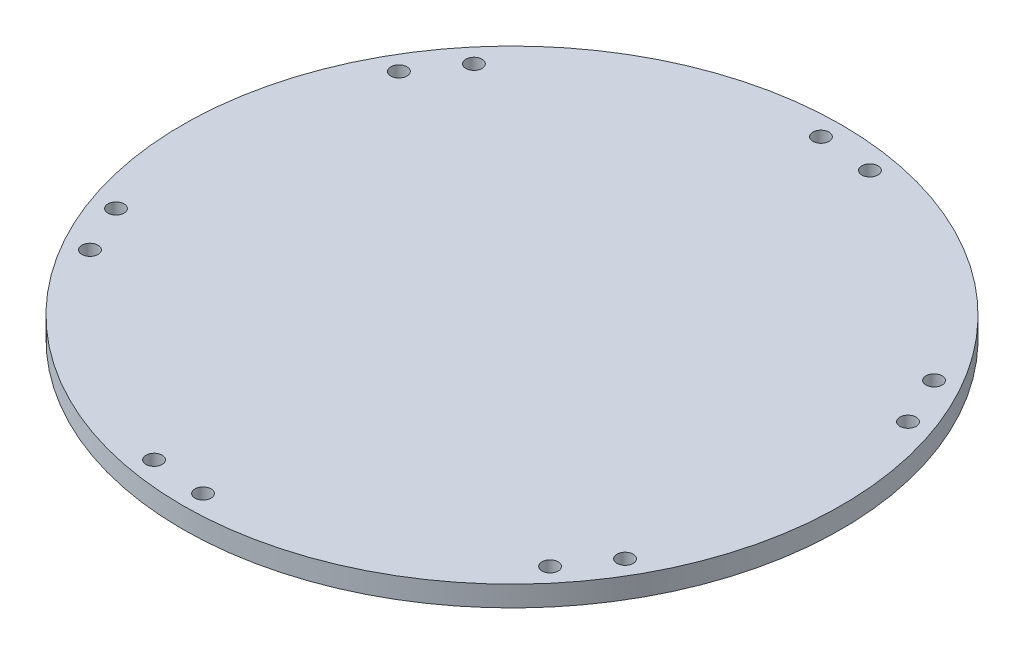
from build123d import *

# Parameters (mm, degrees)
BACK_PLATE_MAIN_R          = 101.6
BOSS_EXTRUDE1_DEPTH        = 6.35
F_9_0_196_DIAMETER_HOLE1_D = 4.9784
CLEARANCE_CUTOUT_R         = 25.4
CUT_EXTRUDE1_DEPTH         = 3.81


with BuildPart() as part:
    # Back Plate Main → Boss-Extrude1 (new body)
    with BuildSketch(Plane(origin=(0, 0, 0), x_dir=(1, 0, 0), z_dir=(0, 1, 0))):
        with Locations(Location((0, 0, 0), (0, 0, 270))):
            Circle(BACK_PLATE_MAIN_R)
    extrude(amount=-BOSS_EXTRUDE1_DEPTH)

    # #9 (0.196) Diameter Hole1 (through all)
    with Locations(Plane(origin=(0, 0, 0), x_dir=(1, 0, 0), z_dir=(0, 1, 0))):
        with Locations((0, 95.25), (82.48891971, 47.625), (82.48891971, -47.625), (0, -95.25), (-82.48891971, -47.625), (-82.48891971, 47.625), (-72.965733207, 61.225519823), (16.539988923, 93.802938474), (89.50572213, 32.577418652), (72.965733207, -61.225519823), (-16.539988923, -93.802938474), (-89.50572213, -32.577418652)):
            Hole(F_9_0_196_DIAMETER_HOLE1_D / 2)

    # Clearance Cutout → Cut-Extrude1 (cut)
    with BuildSketch(Plane.XZ.offset(6.35)):
        with Locations(Location((0, 0, 0), (0, 0, 270))):
            Circle(CLEARANCE_CUTOUT_R)
    extrude(amount=-CUT_EXTRUDE1_DEPTH, mode=Mode.SUBTRACT)


solid = part.part
